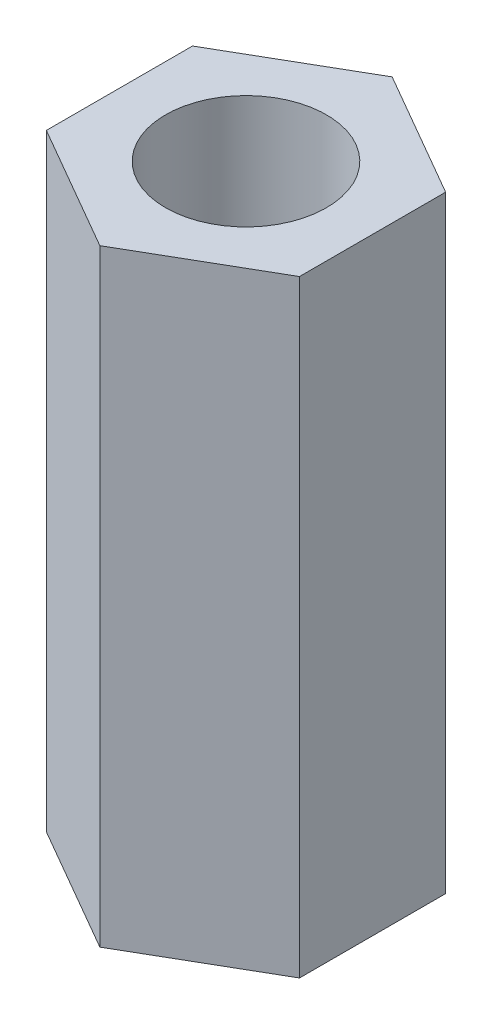
from build123d import *

# Parameters (mm, degrees)
SKETCH1_R           = 1.59
BOSS_EXTRUDE1_DEPTH = 12


with BuildPart() as part:
    # Sketch1 → Boss-Extrude1 (new body)
    with BuildSketch(Plane(origin=(0, 0, 0), x_dir=(1, 0, 0), z_dir=(0, 1, 0))):
        Polygon((0, 2.887), (2.500215341, 1.4435), (2.500215341, -1.4435), (0, -2.887), (-2.500215341, -1.4435), (-2.500215341, 1.4435), align=None)
        with Locations(Location((0, 0, 0), (0, 0, 270))):
            Circle(SKETCH1_R, mode=Mode.SUBTRACT)
    extrude(amount=BOSS_EXTRUDE1_DEPTH)


solid = part.part
